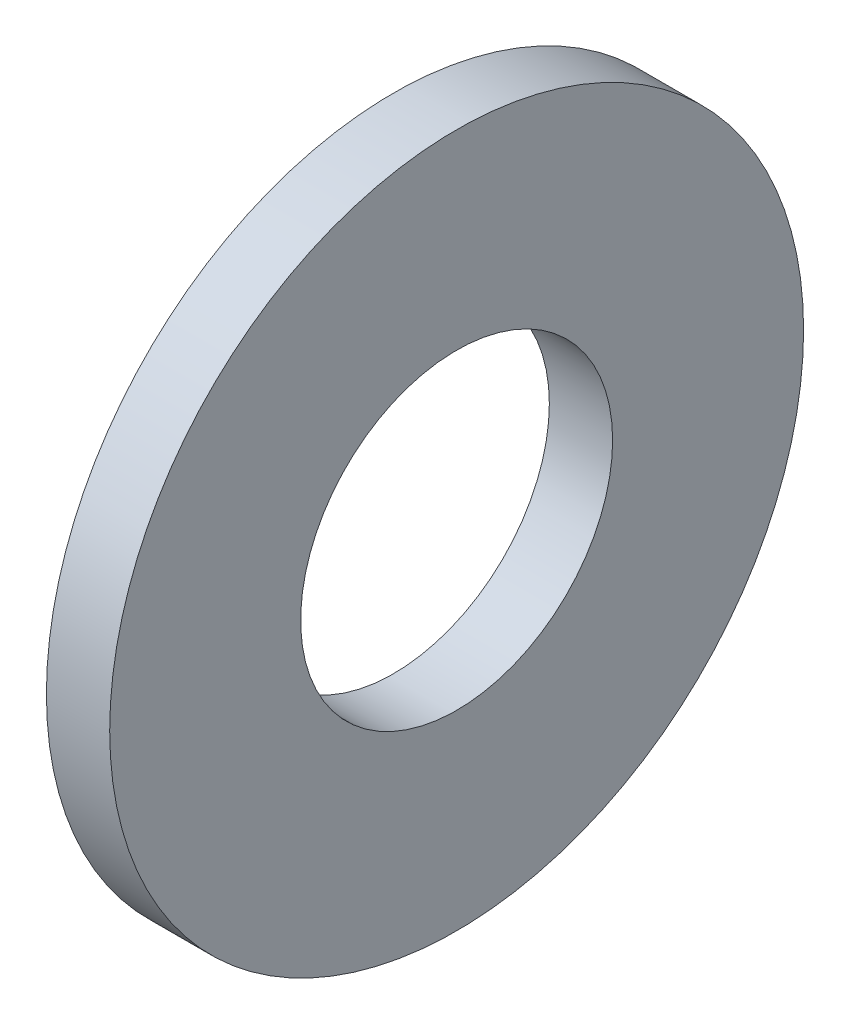
from build123d import *

# Parameters (mm, degrees)
SKETCH1_R           = 7.9375
SKETCH1_R_2         = 3.5687
BOSS_EXTRUDE1_DEPTH = 1.4478


with BuildPart() as part:
    # Sketch1 → Boss-Extrude1 (new body)
    with BuildSketch(Plane(origin=(0, 0, 0), x_dir=(0, 0, -1), z_dir=(1, 0, 0))):
        Circle(SKETCH1_R)
        Circle(SKETCH1_R_2, mode=Mode.SUBTRACT)
    extrude(amount=BOSS_EXTRUDE1_DEPTH)


solid = part.part
